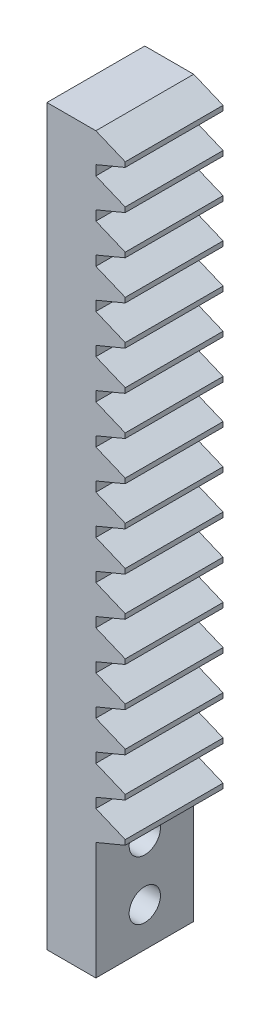
from build123d import *

# Parameters (mm, degrees)
ESQUISSE1_W                = 10
ESQUISSE1_H                = 75
BOSS_EXTRU_1_DEPTH         = 5
BOSS_EXTRU_2_DEPTH         = 10
R_P_TITION_LIN_AIRE1_COUNT = 16
R_P_TITION_LIN_AIRE1_PITCH = 4
ESQUISSE3_R                = 1.6
ENL_V_MAT_EXTRU_1_DEPTH    = 10


with BuildPart() as part:
    # Esquisse1 → Boss.-Extru.1 (new body)
    with BuildSketch(Plane(origin=(0, 0, 0), x_dir=(0, 0, -1), z_dir=(1, 0, 0))):
        with Locations((5, 37.5)):
            Rectangle(ESQUISSE1_W, ESQUISSE1_H)
    extrude(amount=-BOSS_EXTRU_1_DEPTH)

    # Esquisse2 → Boss.-Extru.2 (add)
    with BuildSketch(Plane.XY):
        Polygon((0, 75), (3, 73.75), (3, 73.25), (0, 72), align=None)
    boss_extru_2 = extrude(amount=-BOSS_EXTRU_2_DEPTH)

    # Répétition linéaire1: Boss.-Extru.2 ×16
    with Locations(*[(0, -i * R_P_TITION_LIN_AIRE1_PITCH, 0) for i in range(1, R_P_TITION_LIN_AIRE1_COUNT)]):
        add(boss_extru_2)

    # Esquisse3 → Enlèv. mat.-Extru.1 (cut)
    with BuildSketch(Plane(origin=(0, 0, 0), x_dir=(0, 0, -1), z_dir=(1, 0, 0))):
        with Locations((5, 10)):
            Circle(ESQUISSE3_R)
        with Locations((5, 4)):
            Circle(ESQUISSE3_R)
    extrude(amount=-ENL_V_MAT_EXTRU_1_DEPTH, mode=Mode.SUBTRACT)


solid = part.part
